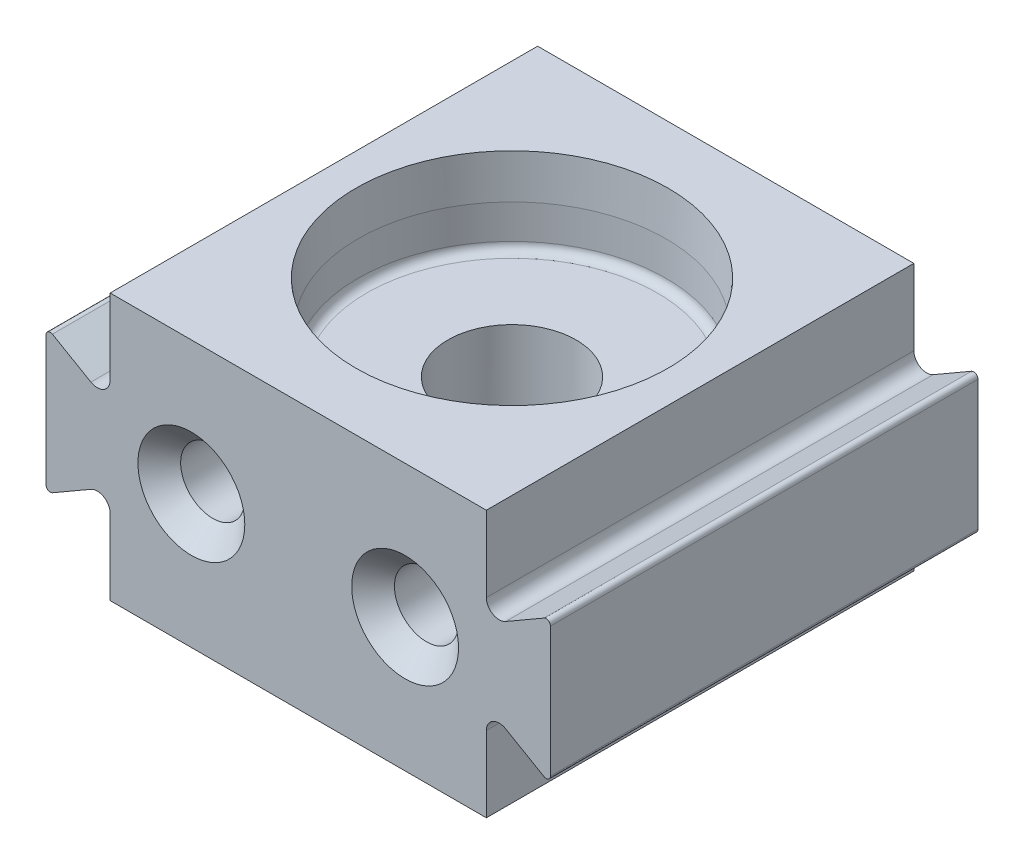
from build123d import *

# Parameters (mm, degrees)
BOSS_EXTRUDE1_DEPTH = 20
SKETCH2_R           = 7.2
CUT_EXTRUDE1_DEPTH  = 4
SKETCH3_R           = 3
CUT_EXTRUDE2_DEPTH  = 26.061299571
SKETCH4_R           = 1.5
CUT_EXTRUDE3_DEPTH  = 36.603512784
CHAMFER1_SIZE       = 1
FILLET1_R           = 0.4
CHAMFER2_SIZE       = 0.1
CHAMFER2_SIZE2      = 2
CHAMFER3_SIZE       = 2
CHAMFER3_SIZE2      = 0.1


with BuildPart() as part:
    # Sketch1 → Boss-Extrude1 (new body)
    with BuildSketch(Plane.XY):
        with BuildLine():
            Line((-8.092893219, -26.668003347), (0.707106781, -26.668003347))
            Line((0.707106781, -26.668003347), (0.707106781, -14.203901732))
            Line((0.707106781, -14.203901732), (-8.092893219, -14.203901732))
            Line((-8.092893219, -14.203901732), (-8.092893219, -17.743132217))
            ThreePointArc((-8.092893219, -17.743132217), (-8.392893219, -18.262747459), (-8.992893219, -18.262747459))
            Line((-8.992893219, -18.262747459), (-10.792893219, -17.223516975))
            ThreePointArc((-10.792893219, -17.223516975), (-10.992893219, -17.223516975), (-11.092893219, -17.396722055))
            Line((-11.092893219, -17.396722055), (-11.092893219, -23.475183024))
            ThreePointArc((-11.092893219, -23.475183024), (-10.992893219, -23.648388105), (-10.792893219, -23.648388105))
            Line((-10.792893219, -23.648388105), (-8.992893219, -22.609157621))
            ThreePointArc((-8.992893219, -22.609157621), (-8.392893219, -22.609157621), (-8.092893219, -23.128772863))
            Line((-8.092893219, -23.128772863), (-8.092893219, -26.668003347))
        make_face()
    extrude(amount=-BOSS_EXTRUDE1_DEPTH)

    # Mirror1: part across plane


with BuildPart() as part_1:
    add(part.part)
    add(part.part.mirror(Plane(origin=(0.707106781, -26.668003347, -20), x_dir=(0, 0, 1), z_dir=(1, 0, 0))))

    # Sketch2 → Cut-Extrude1 (cut)
    with BuildSketch(Plane(origin=(0, -14.203901732, 0), x_dir=(1, 0, 0), z_dir=(0, 1, 0))):
        with Locations(Location((0.707106781, 10, 0), (0, 0, 270))):
            Circle(SKETCH2_R)
    cut_extrude1 = extrude(amount=-CUT_EXTRUDE1_DEPTH, mode=Mode.SUBTRACT)

    # Mirror2: Cut-Extrude1 across plane
    add(cut_extrude1.mirror(Plane(origin=(0, -20.43595254, 0), x_dir=(0, 0, 1), z_dir=(0, -1, 0))), mode=Mode.SUBTRACT)

    # Sketch3 → Cut-Extrude2 (cut, through all)
    with BuildSketch(Plane(origin=(0, -18.203901732, 0), x_dir=(1, 0, 0), z_dir=(0, 1, 0))):
        with Locations(Location((0.707106781, 10, 0), (0, 0, 270))):
            Circle(SKETCH3_R)
    extrude(amount=-CUT_EXTRUDE2_DEPTH, mode=Mode.SUBTRACT)

    # Sketch4 → Cut-Extrude3 (cut, through all)
    with BuildSketch(Plane(origin=(0, 0, -20), x_dir=(-1, 0, 0), z_dir=(0, 0, -1))):
        with Locations((4.292893219, -20.43595254)):
            Circle(SKETCH4_R)
        with Locations(Location((-5.707106781, -20.43595254, 0), (0, 0, 180))):
            Circle(SKETCH4_R)
    extrude(amount=-CUT_EXTRUDE3_DEPTH, mode=Mode.SUBTRACT)

    # Chamfer1
    chamfer1_edges = [part_1.edges().sort_by_distance(p)[0] for p in [
        (-2.792893219, -20.43595254, 0),
        (-2.792893219, -20.43595254, -20),
        (4.207106781, -20.43595254, 0),
        (4.207106781, -20.43595254, -20),
    ]]
    chamfer(chamfer1_edges, length=CHAMFER1_SIZE)

    # Fillet1
    fillet1_edges = [part_1.edges().sort_by_distance(p)[0] for p in [
        (0.707106781, -18.203901732, -17.2),
        (0.707106781, -22.668003347, -17.2),
    ]]
    fillet(fillet1_edges, radius=FILLET1_R)

    # Chamfer2
    chamfer2_edges = [part_1.edges().sort_by_distance(p)[0] for p in [
        (0.707106781, -14.203901732, -17.2),
    ]]
    chamfer2_side = [part_1.faces().sort_by_distance(p)[0] for p in [
        (-7.826480006, -14.203901732, -10),
    ]]
    chamfer(chamfer2_edges, length=CHAMFER2_SIZE, length2=CHAMFER2_SIZE2, reference=chamfer2_side[0])

    # Chamfer3
    chamfer3_edges = [part_1.edges().sort_by_distance(p)[0] for p in [
        (0.707106781, -26.668003347, -17.2),
    ]]
    chamfer3_side = [part_1.faces().sort_by_distance(p)[0] for p in [
        (0.707106781, -24.868003347, -17.2),
    ]]
    chamfer(chamfer3_edges, length=CHAMFER3_SIZE, length2=CHAMFER3_SIZE2, reference=chamfer3_side[0])


solid = part_1.part
